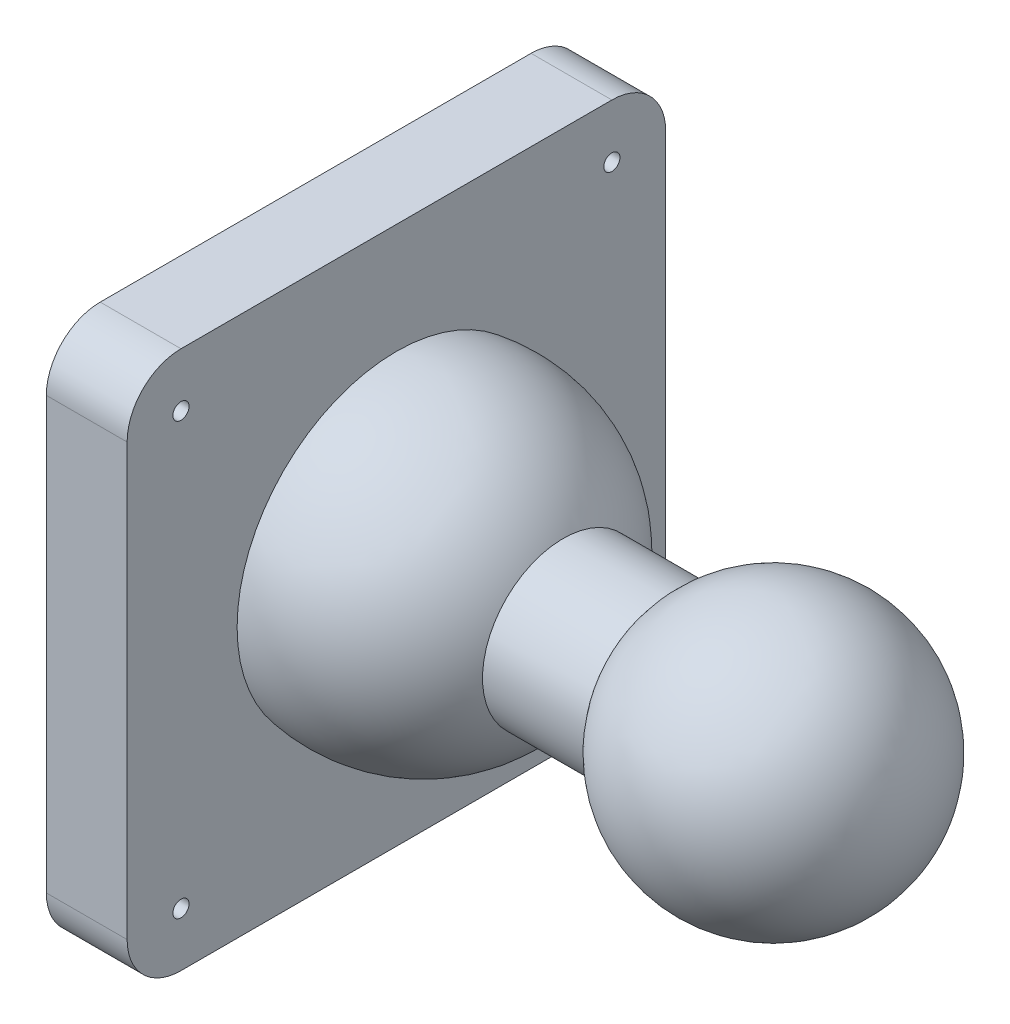
from build123d import *

# Parameters (mm, degrees)
SALIENTE_EXTRUIR2_START             = -40
CROQUIS4_R                          = 15
SALIENTE_EXTRUIR2_DEPTH             = 10
SALIENTE_EXTRUIR2_DIRECTION_2_REACH = 97
CROQUIS6_W                          = 100
CROQUIS6_H                          = 100
SALIENTE_EXTRUIR3_DEPTH             = 15
REDONDEO1_R                         = 10
CROQUIS7_R                          = 1.5
CORTAR_EXTRUIR1_DEPTH               = 15


with BuildPart() as part:
    # Croquis2 → Revolución-Lámina1 (revolve)
    with BuildSketch(Plane(origin=(0, 0, 0), x_dir=(1, 0, 0), z_dir=(0, 1, 0))):
        with BuildLine():
            ThreePointArc((25, 0), (17.67766953, 17.67766953), (0, 25))
            Line((0, 25), (0, 0))
            Line((0, 0), (-5, 0))
            Line((-5, 0), (-5, 29.580398915))
            ThreePointArc((-5, 29.580398915), (19.364916731, 22.912878475), (30, 0))
            Line((30, 0), (25, 0))
        make_face()
    revolve(axis=Axis((0, 0, 0), (1, 0, 0)))

    # Croquis4 → Saliente-Extruir2 (add)
    with BuildSketch(Plane.ZY.offset(5).offset(SALIENTE_EXTRUIR2_START)):
        with Locations(Location((0, 0, 0), (0, 0, 180))):
            Circle(CROQUIS4_R)
    extrude(amount=-SALIENTE_EXTRUIR2_DEPTH)

    # Croquis4 → Saliente-Extruir2 direction 2 (add, up to next)
    with BuildSketch(Plane.ZY.offset(5).offset(SALIENTE_EXTRUIR2_START), mode=Mode.PRIVATE) as saliente_extruir2_direction_2_sk1:
        with Locations(Location((0, 0, 0), (0, 0, 180))):
            Circle(CROQUIS4_R)
    saliente_extruir2_direction_2_tool1 = extrude(saliente_extruir2_direction_2_sk1.sketch, amount=SALIENTE_EXTRUIR2_DIRECTION_2_REACH, mode=Mode.PRIVATE) - part.part
    add(saliente_extruir2_direction_2_tool1.solids().sort_by_distance((35, 0, 0))[0])

    # Croquis6 → Saliente-Extruir3 (add)
    with BuildSketch(Plane.ZY.offset(5)):
        Rectangle(CROQUIS6_W, CROQUIS6_H)
    extrude(amount=SALIENTE_EXTRUIR3_DEPTH)

    # Redondeo1
    redondeo1_edges = [part.edges().sort_by_distance(p)[0] for p in [
        (-12.5, -50, 50),
        (-12.5, 50, 50),
        (-12.5, 50, -50),
        (-12.5, -50, -50),
    ]]
    fillet(redondeo1_edges, radius=REDONDEO1_R)

    # Croquis7 → Cortar-Extruir1 (cut)
    with BuildSketch(Plane(origin=(-5, 0, 0), x_dir=(0, 0, -1), z_dir=(1, 0, 0))):
        with Locations((-40, 40)):
            Circle(CROQUIS7_R)
        with Locations(Location((40, 40, 0), (0, 0, 180))):
            Circle(CROQUIS7_R)
        with Locations((40, -40)):
            Circle(CROQUIS7_R)
        with Locations(Location((-40, -40, 0), (0, 0, 180))):
            Circle(CROQUIS7_R)
    extrude(amount=-CORTAR_EXTRUIR1_DEPTH, mode=Mode.SUBTRACT)


with BuildPart() as body_2:
    # Croquis5 → Revolución1 (revolve)
    with BuildSketch(Plane(origin=(0, 0, 0), x_dir=(1, 0, 0), z_dir=(0, 1, 0)), mode=Mode.PRIVATE) as revoluci_n1_sk:
        with BuildLine():
            Line((45, 0), (45, 15))
            ThreePointArc((45, 15), (72.90569415, 23.717082451), (90, 0))
            Line((90, 0), (45, 0))
        make_face()
    revolve(revoluci_n1_sk.sketch.rotate(Axis((45, 0, 0), (1, 0, 0)), 180), axis=Axis((45, 0, 0), (1, 0, 0)))


solid = Compound([part.part, body_2.part])
